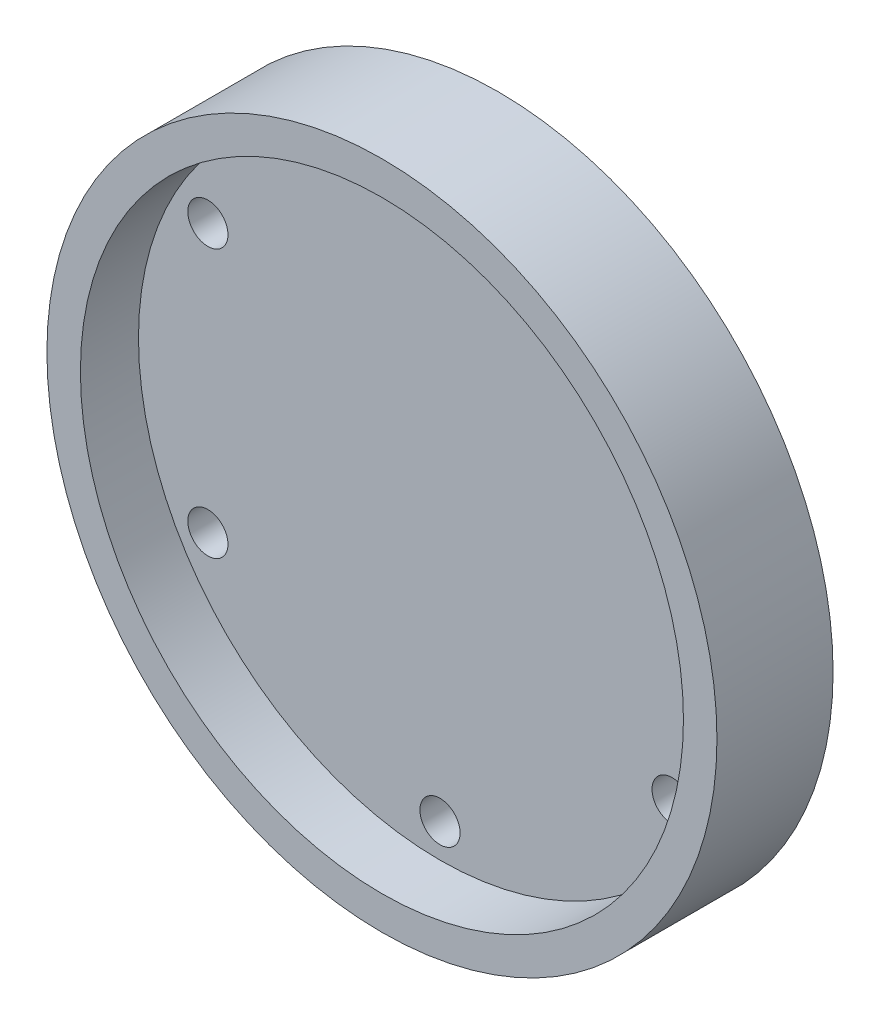
from build123d import *

# Parameters (mm, degrees)
SKETCH_1_R          = 75
EXTRUDE_1_DEPTH     = 26
SKETCH_3_R          = 67.5
CUT_EXTRUDE_2_DEPTH = 13
SKETCH_4_R          = 4.5
CUT_EXTRUDE_3_DEPTH = 110.206226929
SKETCH_5_R          = 25
EXTRUDE_2_DEPTH     = 5
SKETCH_8_R          = 17.5
EXTRUDE_4_DEPTH     = 23


with BuildPart() as part:
    # 草图1 → 拉伸1 (new body)
    with BuildSketch(Plane.XY):
        with Locations(Location((0, 0, 0), (0, 0, 180))):
            Circle(SKETCH_1_R)
    extrude(amount=EXTRUDE_1_DEPTH)

    # 草图3 → 切除-拉伸2 (cut)
    with BuildSketch(Plane.XY.offset(26)):
        Circle(SKETCH_3_R)
    extrude(amount=-CUT_EXTRUDE_2_DEPTH, mode=Mode.SUBTRACT)

    # 草图4 → 切除-拉伸3 (cut, through all)
    with BuildSketch(Plane(origin=(0, 0, 0), x_dir=(-1, 0, 0), z_dir=(0, 0, -1))):
        with Locations((0, 60)):
            Circle(SKETCH_4_R)
        with Locations((51.961524227, 30)):
            Circle(SKETCH_4_R)
        with Locations((51.961524227, -30)):
            Circle(SKETCH_4_R)
        with Locations((0, -60)):
            Circle(SKETCH_4_R)
        with Locations((-51.961524227, -30)):
            Circle(SKETCH_4_R)
        with Locations((-51.961524227, 30)):
            Circle(SKETCH_4_R)
    extrude(amount=-CUT_EXTRUDE_3_DEPTH, mode=Mode.SUBTRACT)

    # 草图5 → 拉伸2 (add)
    with BuildSketch(Plane(origin=(0, 0, 0), x_dir=(-1, 0, 0), z_dir=(0, 0, -1))):
        with Locations(Location((0, 0, 0), (0, 0, 180))):
            Circle(SKETCH_5_R)
    extrude(amount=EXTRUDE_2_DEPTH)

    # 草图8 → 拉伸4 (add)
    with BuildSketch(Plane(origin=(0, 0, -5), x_dir=(-1, 0, 0), z_dir=(0, 0, -1))):
        Circle(SKETCH_8_R)
    extrude(amount=EXTRUDE_4_DEPTH)


solid = part.part
